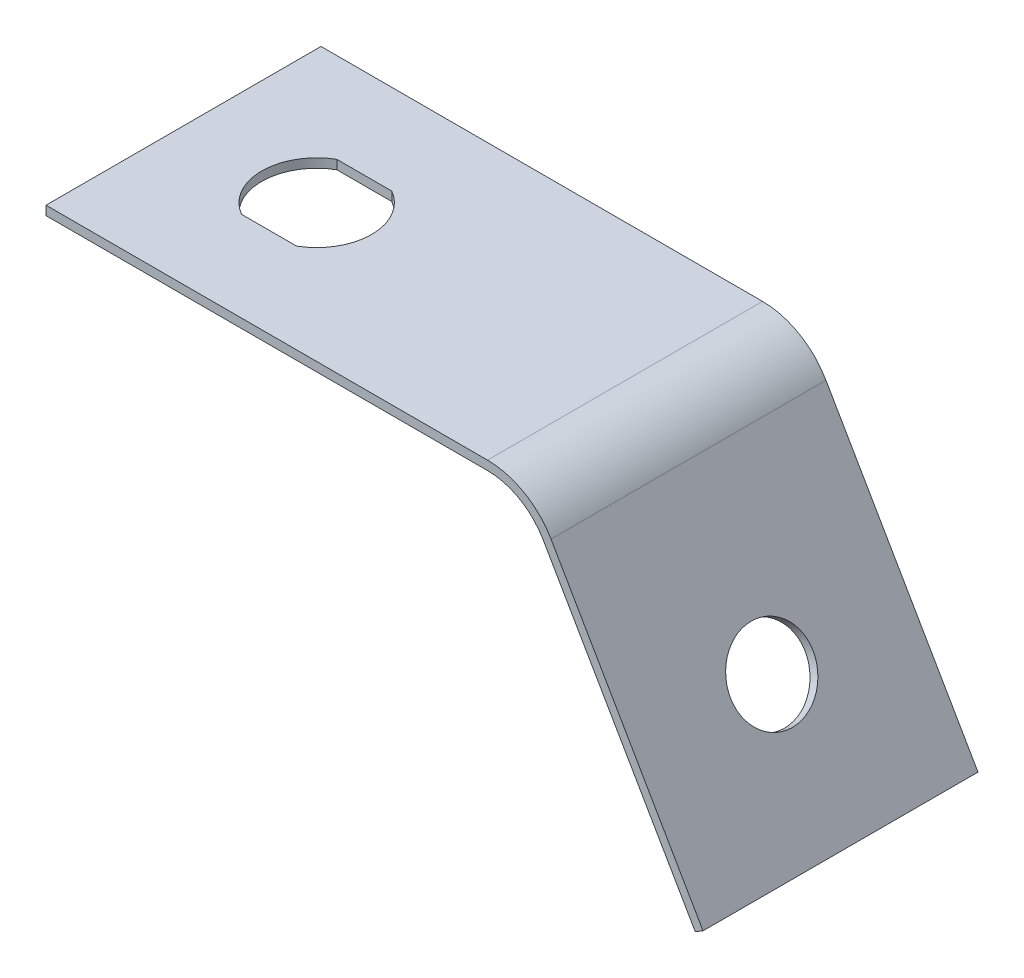
from build123d import *

# Parameters (mm, degrees)
EXTRUDE_THIN1_DEPTH = 12.7
CUT_EXTRUDE1_DEPTH  = 55.111973556
SKETCH3_R           = 3.81
CUT_EXTRUDE2_DEPTH  = 54.488360816


with BuildPart() as part:
    # Sketch1 → Extrude-Thin1 (new, symmetric)
    with BuildSketch(Plane.XY):
        with BuildLine():
            Line((-44.45, -0.4191), (-3.666174209, -0.4191))
            ThreePointArc((-3.666174209, -0.4191), (-0.700724209, -1.213689933), (1.470135858, -3.38455))
            Line((1.470135858, -3.38455), (15.512048753, -27.70585657))
            Line((15.512048753, -27.70585657), (16.237951247, -27.28675657))
            Line((16.237951247, -27.28675657), (2.196038351, -2.96545))
            ThreePointArc((2.196038351, -2.96545), (-0.281624209, -0.487787439), (-3.666174209, 0.4191))
            Line((-3.666174209, 0.4191), (-44.45, 0.4191))
            Line((-44.45, 0.4191), (-44.45, -0.4191))
        make_face()
    extrude(amount=EXTRUDE_THIN1_DEPTH, both=True)

    # Sketch2 → Cut-Extrude1 (cut, through all)
    with BuildSketch(Plane(origin=(0, 0.4191, 0), x_dir=(1, 0, 0), z_dir=(0, 1, 0))):
        with BuildLine():
            Line((-34.689149884, 4.399409051), (-29.609149884, 4.399409051))
            ThreePointArc((-29.609149884, 4.399409051), (-27.069149884, 0), (-29.609149884, -4.399409051))
            Line((-29.609149884, -4.399409051), (-34.689149884, -4.399409051))
            ThreePointArc((-34.689149884, -4.399409051), (-37.229149884, 0), (-34.689149884, 4.399409051))
        make_face()
    extrude(amount=-CUT_EXTRUDE1_DEPTH, mode=Mode.SUBTRACT)

    # Sketch3 → Cut-Extrude2 (cut, through all)
    with BuildSketch(Plane(origin=(-0.362951247, -0.20955, 0), x_dir=(0, 0, 1), z_dir=(-0.8660254037844389, -0.49999999999999983, 0))):
        with Locations(Location((0, -19.05, 0), (0, 0, 270))):
            Circle(SKETCH3_R)
    extrude(amount=-CUT_EXTRUDE2_DEPTH, mode=Mode.SUBTRACT)


solid = part.part
